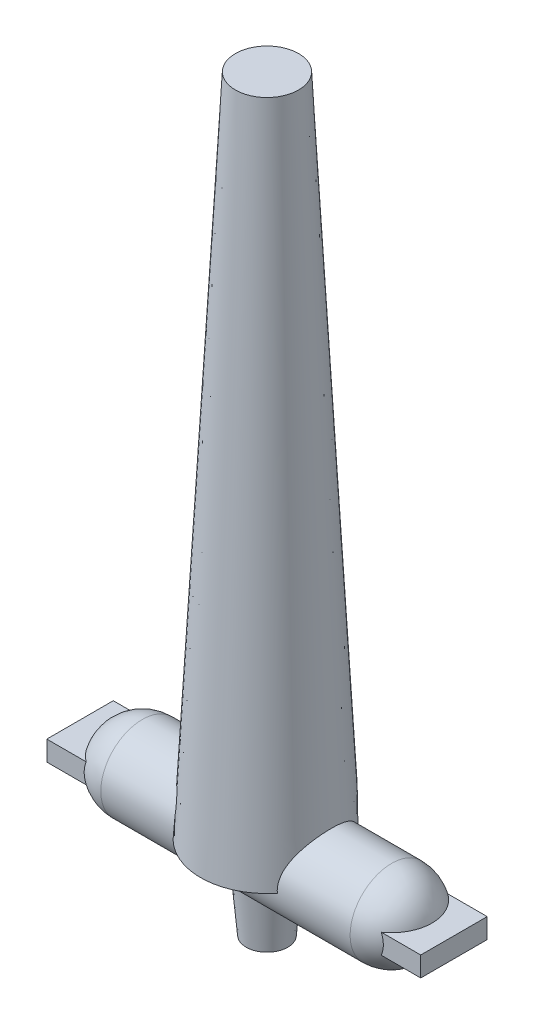
from build123d import *

# Parameters (mm, degrees)
SKETCH3_R           = 3.175
BOSS_EXTRUDE1_DEPTH = 12.7
FILLET1_R           = 3.175
SKETCH4_W           = 5.08
SKETCH4_H           = 1.524
BOSS_EXTRUDE2_DEPTH = 14.2875
SKETCH5_R           = 1.5875
BOSS_EXTRUDE3_DEPTH = 6.35
DRAFT1_ANGLE        = 5


with BuildPart() as part:
    # Sketch1 → Revolve1 (revolve)
    with BuildSketch(Plane.XY, mode=Mode.PRIVATE) as revolve1_sk:
        Polygon((0, 50.8), (0, 0), (5.075315188, 0), (2.413, 50.8), align=None)
    revolve(revolve1_sk.sketch.rotate(Axis((0, 50.8, 0), (0, -1, 0)), 180), axis=Axis((0, 50.8, 0), (0, -1, 0)))

    # Sketch3 → Boss-Extrude1 (add, symmetric)
    with BuildSketch(Plane(origin=(0, 0, 0), x_dir=(0, 0, -1), z_dir=(1, 0, 0))):
        Circle(SKETCH3_R)
    extrude(amount=BOSS_EXTRUDE1_DEPTH, both=True)

    # Fillet1
    fillet1_edges = [part.edges().sort_by_distance(p)[0] for p in [
        (-12.7, 0, 3.175),
        (12.7, 0, 3.175),
    ]]
    fillet(fillet1_edges, radius=FILLET1_R)

    # Sketch4 → Boss-Extrude2 (add, symmetric)
    with BuildSketch(Plane(origin=(0, 0, 0), x_dir=(0, 0, -1), z_dir=(1, 0, 0))):
        Rectangle(SKETCH4_W, SKETCH4_H)
    extrude(amount=BOSS_EXTRUDE2_DEPTH, both=True)

    # Sketch5 → Boss-Extrude3 (add)
    with BuildSketch(Plane(origin=(0, 0, 0), x_dir=(1, 0, 0), z_dir=(0, 1, 0))):
        with Locations(Location((0, 0, 0), (0, 0, 270))):
            Circle(SKETCH5_R)
    extrude(amount=-BOSS_EXTRUDE3_DEPTH)

    # Draft1
    draft1_faces = [part.faces().sort_by_distance(p)[0] for p in [
        (0, -4.549815329, -1.5875),
    ]]
    draft(draft1_faces, Plane(origin=(0, -6.35, 0), x_dir=(0, 0, -1), z_dir=(0, -1, 0)), DRAFT1_ANGLE)


solid = part.part
